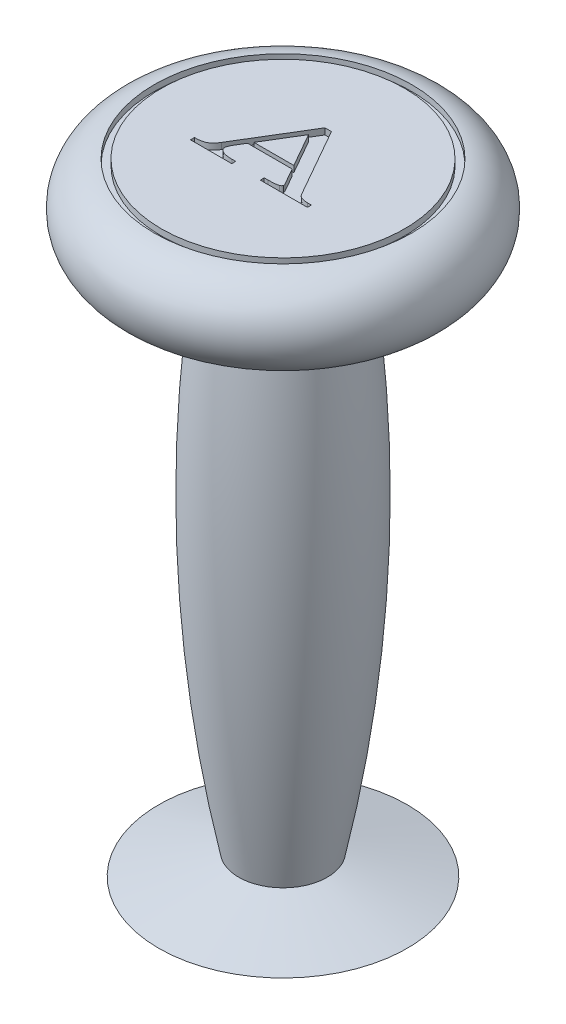
from build123d import *

# Parameters (mm, degrees)
SKETCH2_R          = 31.049864635
SKETCH2_R_2        = 29.352746911
CUT_EXTRUDE1_DEPTH = 1.5
CUT_EXTRUDE2_DEPTH = 1.5
SKETCH4_R          = 10
CUT_EXTRUDE3_DEPTH = 15


with BuildPart() as part:
    # Sketch1 → Revolve1 (revolve)
    with BuildSketch(Plane.XY, mode=Mode.PRIVATE) as revolve1_sk:
        with BuildLine():
            Line((0, 0), (0, 150))
            Line((0, 150), (30, 150))
            ThreePointArc((30, 150), (40.388997365, 139.611002635), (30, 129.22200527))
            Line((30, 129.22200527), (15, 129.22200527))
            ThreePointArc((15, 129.22200527), (18.060262967, 67.017481004), (10.681483474, 5.176380902))
            Line((10.681483474, 5.176380902), (30, 0))
            Line((30, 0), (0, 0))
        make_face()
    revolve(revolve1_sk.sketch.rotate(Axis((0, 0, 0), (0, 1, 0)), 90), axis=Axis((0, 0, 0), (0, 1, 0)))

    # Sketch2 → Cut-Extrude1 (cut)
    with BuildSketch(Plane(origin=(0, 150, 0), x_dir=(1, 0, 0), z_dir=(0, 1, 0))):
        with Locations(Location((0, 0, 0), (0, 0, 270))):
            Circle(SKETCH2_R)
        with Locations(Location((0, 0, 0), (0, 0, 270))):
            Circle(SKETCH2_R_2, mode=Mode.SUBTRACT)
    extrude(amount=-CUT_EXTRUDE1_DEPTH, mode=Mode.SUBTRACT)

    # Sketch3 → Cut-Extrude2 (cut)
    with BuildSketch(Plane(origin=(0, 150, 0), x_dir=(1, 0, 0), z_dir=(0, 1, 0))):
        with BuildLine():
            Line((-1.37380559, 11.490731507), (0.200524373, 11.490731507))
            Line((0.200524373, 11.490731507), (9.720590268, -5.252730688))
            add(Edge.make_bspline(
                [(9.720590268, -5.252730688), (9.775425809, -5.336848559), (9.884824755, -5.504666839), (10.109686394, -5.712624674), (10.364541879, -5.897673839), (10.667511649, -6.039567124), (11.004675554, -6.156309685), (11.38520549, -6.229119021), (11.802008113, -6.284806014), (12.094830032, -6.288182504), (12.24692682, -6.289936311)],
                knots=[0, 0, 0, 0, 0.840177971, 1.676186298, 2.553734707, 3.476611938, 4.473478221, 5.543186981, 6.723888672, 8, 8, 8, 8], degree=3))
            Line((12.24692682, -6.289936311), (13.135960211, -6.289936311))
            Line((13.135960211, -6.289936311), (13.135960211, -7.238238595))
            Line((13.135960211, -7.238238595), (1.756332807, -7.238238595))
            Line((1.756332807, -7.238238595), (1.756332807, -6.289936311))
            Line((1.756332807, -6.289936311), (2.663887727, -6.289936311))
            add(Edge.make_bspline(
                [(2.663887727, -6.289936311), (2.80588403, -6.289116844), (3.080045555, -6.287534645), (3.475468257, -6.278554582), (3.838258818, -6.253484746), (4.168672223, -6.231533819), (4.464628818, -6.191836085), (4.72989755, -6.153782934), (4.962737436, -6.103045308), (5.105277775, -6.058706001), (5.171702751, -6.038043517)],
                knots=[0, 0, 0, 0, 1.347381447, 2.601477244, 3.751787047, 4.797723897, 5.742291361, 6.584045584, 7.340153537, 8, 8, 8, 8], degree=3))
            add(Edge.make_bspline(
                [(5.171702751, -6.038043517), (5.246729637, -6.008546001), (5.384240305, -5.954482408), (5.546196056, -5.82449007), (5.656795371, -5.670049367), (5.666823825, -5.551932666), (5.671784033, -5.493510565)],
                knots=[0, 0, 0, 0, 1.216663799, 2.229923951, 3.124496705, 4, 4, 4, 4], degree=3))
            add(Edge.make_bspline(
                [(5.671784033, -5.493510565), (5.664990337, -5.418196965), (5.650521617, -5.25779954), (5.577280328, -5.114104756), (5.538429024, -5.037880952)],
                knots=[0, 0, 0, 0, 0.939087396, 2, 2, 2, 2], degree=3))
            Line((5.538429024, -5.037880952), (3.278802489, -1.074273751))
            Line((3.278802489, -1.074273751), (-7.474797235, -1.074273751))
            Line((-7.474797235, -1.074273751), (-8.852798991, -3.34871751))
            add(Edge.make_bspline(
                [(-8.852798991, -3.34871751), (-8.928421945, -3.490696961), (-9.068680664, -3.754027804), (-9.224116161, -4.138619247), (-9.332642883, -4.475115772), (-9.346569932, -4.68905318), (-9.352880274, -4.785988158)],
                knots=[0, 0, 0, 0, 1.256117806, 2.329735437, 3.2432036, 4, 4, 4, 4], degree=3))
            add(Edge.make_bspline(
                [(-9.352880274, -4.785988158), (-9.343177226, -4.888324501), (-9.323371536, -5.097211653), (-9.141155652, -5.38324454), (-8.868849037, -5.641461835), (-8.567657199, -5.824455709), (-8.282154901, -5.959469659), (-8.032782233, -6.045389303), (-7.761909609, -6.126127912), (-7.464752755, -6.181705917), (-7.144821029, -6.230173712), (-6.801442809, -6.26855562), (-6.43280877, -6.284674672), (-6.179532542, -6.288143581), (-6.048639504, -6.289936311)],
                knots=[0, 0, 0, 0, 0.925715885, 1.889555053, 3.00451202, 4.335528446, 5.081180176, 5.882656101, 6.738094346, 7.656865631, 8.636367395, 9.689735017, 10.806056124, 12, 12, 12, 12], degree=3))
            Line((-6.048639504, -6.289936311), (-5.118858749, -6.289936311))
            Line((-5.118858749, -6.289936311), (-5.118858749, -7.238238595))
            Line((-5.118858749, -7.238238595), (-15.076032728, -7.238238595))
            Line((-15.076032728, -7.238238595), (-15.076032728, -6.289936311))
            add(Edge.make_bspline(
                [(-15.076032728, -6.289936311), (-14.820152301, -6.284911472), (-14.335067052, -6.275385635), (-13.649411461, -6.18740497), (-13.047349106, -6.042660349), (-12.51508477, -5.832556662), (-12.035352921, -5.529178123), (-11.593750012, -5.122125622), (-11.164977743, -4.615349339), (-10.919691242, -4.222803331), (-10.790150922, -4.015492553)],
                knots=[0, 0, 0, 0, 1.192324888, 2.260349586, 3.215193263, 4.072390854, 4.915560629, 5.844785241, 6.861791383, 8, 8, 8, 8], degree=3))
            Line((-10.790150922, -4.015492553), (-1.37380559, 11.490731507))
        make_face()
        Polygon((-1.918338542, 8.075361564), (-6.900629837, -0.125971467), (2.741678149, -0.125971467), align=None, mode=Mode.SUBTRACT)
    extrude(amount=-CUT_EXTRUDE2_DEPTH, mode=Mode.SUBTRACT)

    # Sketch4 → Cut-Extrude3 (cut)
    with BuildSketch(Plane(origin=(0, 0, 0), x_dir=(-1, 0, 0), z_dir=(0, -1, 0))):
        with Locations(Location((0, 0, 0), (0, 0, 90))):
            Circle(SKETCH4_R)
    extrude(amount=-CUT_EXTRUDE3_DEPTH, mode=Mode.SUBTRACT)


solid = part.part
